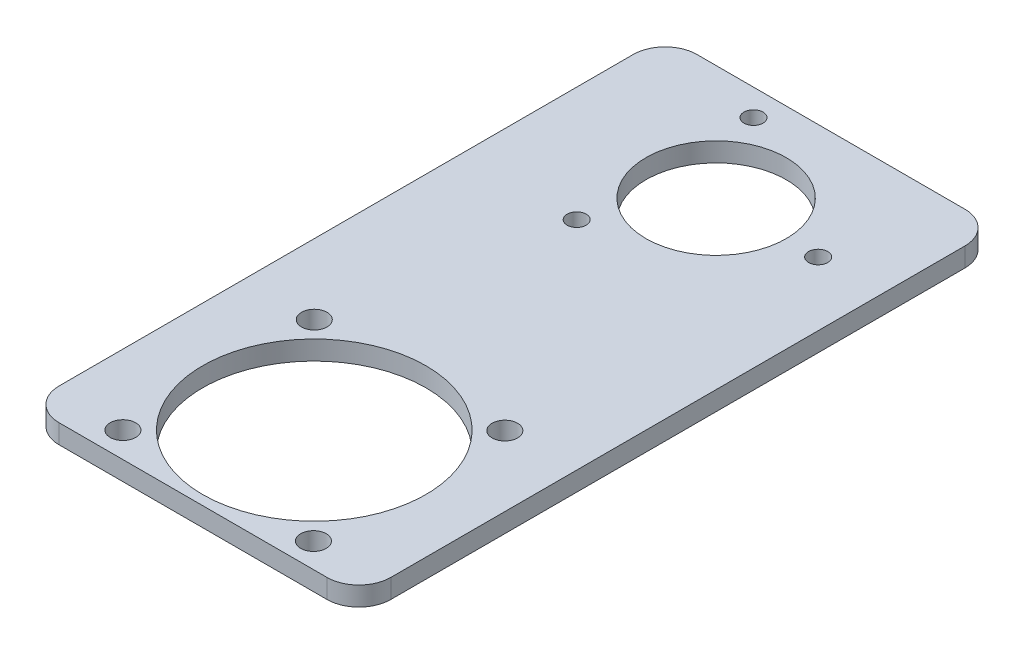
from build123d import *

# Parameters (mm, degrees)
SKETCH1_R           = 17.5
SKETCH1_R_2         = 2
SKETCH1_R_3         = 11
SKETCH1_R_4         = 1.5
BOSS_EXTRUDE1_DEPTH = 3


with BuildPart() as part:
    # Sketch1 → Boss-Extrude1 (new body)
    with BuildSketch(Plane(origin=(0, 0, 0), x_dir=(1, 0, 0), z_dir=(0, 1, 0))):
        with BuildLine():
            Line((-21, -50), (21, -50))
            ThreePointArc((21, -50), (24.535533906, -48.535533906), (26, -45))
            Line((26, -45), (26, 45))
            ThreePointArc((26, 45), (24.535533906, 48.535533906), (21, 50))
            Line((21, 50), (-21, 50))
            ThreePointArc((-21, 50), (-24.535533906, 48.535533906), (-26, 45))
            Line((-26, 45), (-26, -45))
            ThreePointArc((-26, -45), (-24.535533906, -48.535533906), (-21, -50))
        make_face()
        with Locations(Location((0, -31, 0), (0, 0, 270))):
            Circle(SKETCH1_R, mode=Mode.SUBTRACT)
        with Locations(Location((-15, -16, 0), (0, 0, 270))):
            Circle(SKETCH1_R_2, mode=Mode.SUBTRACT)
        with Locations(Location((14.999738727, -16.125204962, 0), (0, 0, 270))):
            Circle(SKETCH1_R_2, mode=Mode.SUBTRACT)
        with Locations(Location((14.999738727, -46.125204962, 0), (0, 0, 270))):
            Circle(SKETCH1_R_2, mode=Mode.SUBTRACT)
        with Locations(Location((-15, -46, 0), (0, 0, 270))):
            Circle(SKETCH1_R_2, mode=Mode.SUBTRACT)
        with Locations(Location((0, 32, 0), (0, 0, 270))):
            Circle(SKETCH1_R_3, mode=Mode.SUBTRACT)
        with Locations(Location((16, 32, 0), (0, 0, 270))):
            Circle(SKETCH1_R_4, mode=Mode.SUBTRACT)
        with Locations(Location((-8, 45.856406461, 0), (0, 0, 270))):
            Circle(SKETCH1_R_4, mode=Mode.SUBTRACT)
        with Locations(Location((-8, 18.143593539, 0), (0, 0, 270))):
            Circle(SKETCH1_R_4, mode=Mode.SUBTRACT)
    extrude(amount=BOSS_EXTRUDE1_DEPTH)


solid = part.part
